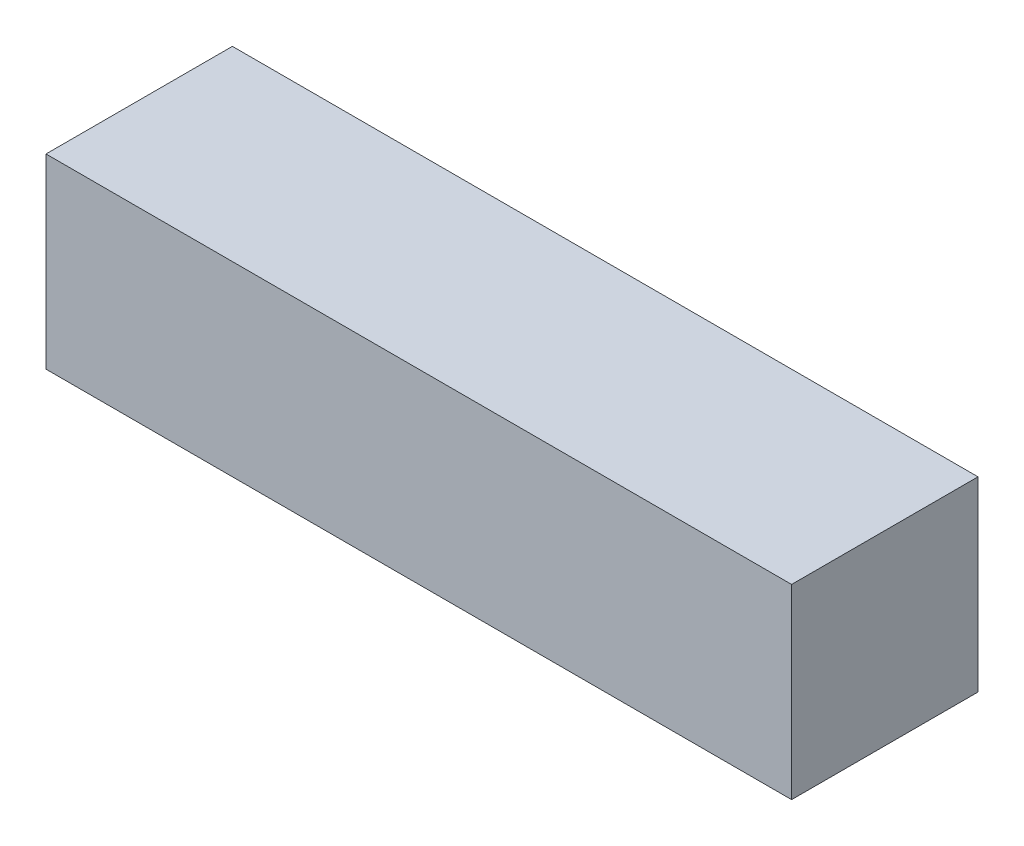
from build123d import *

# Parameters (mm, degrees)
SKETCH1_W           = 2.54
SKETCH1_H           = 2.54
BOSS_EXTRUDE1_DEPTH = 10.16


with BuildPart() as part:
    # Sketch1 → Boss-Extrude1 (new body)
    with BuildSketch(Plane(origin=(0, 0, 0), x_dir=(0, 0, -1), z_dir=(1, 0, 0))):
        with Locations((1.27, 1.27)):
            Rectangle(SKETCH1_W, SKETCH1_H)
    extrude(amount=BOSS_EXTRUDE1_DEPTH)


solid = part.part
